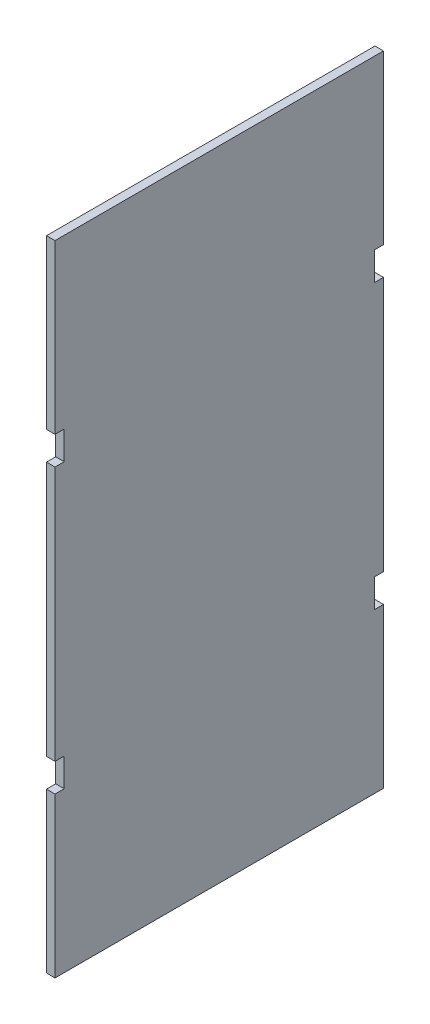
from build123d import *

# Parameters (mm, degrees)
BOSS_EXTRUDE1_DEPTH = 6


with BuildPart() as part:
    # Sketch1 → Boss-Extrude1 (new body)
    with BuildSketch(Plane(origin=(0, 0, 0), x_dir=(0, 0, -1), z_dir=(1, 0, 0))):
        Polygon((0, 0), (232, 0), (232, 112.5), (225.5, 112.5), (225.5, 132.5), (232, 132.5), (232, 312.5), (225.5, 312.5), (225.5, 332.5), (232, 332.5), (232, 451), (0, 451), (0, 332.5), (6.5, 332.5), (6.5, 312.5), (0, 312.5), (0, 132.5), (6.5, 132.5), (6.5, 112.5), (0, 112.5), align=None)
    extrude(amount=BOSS_EXTRUDE1_DEPTH)


solid = part.part
